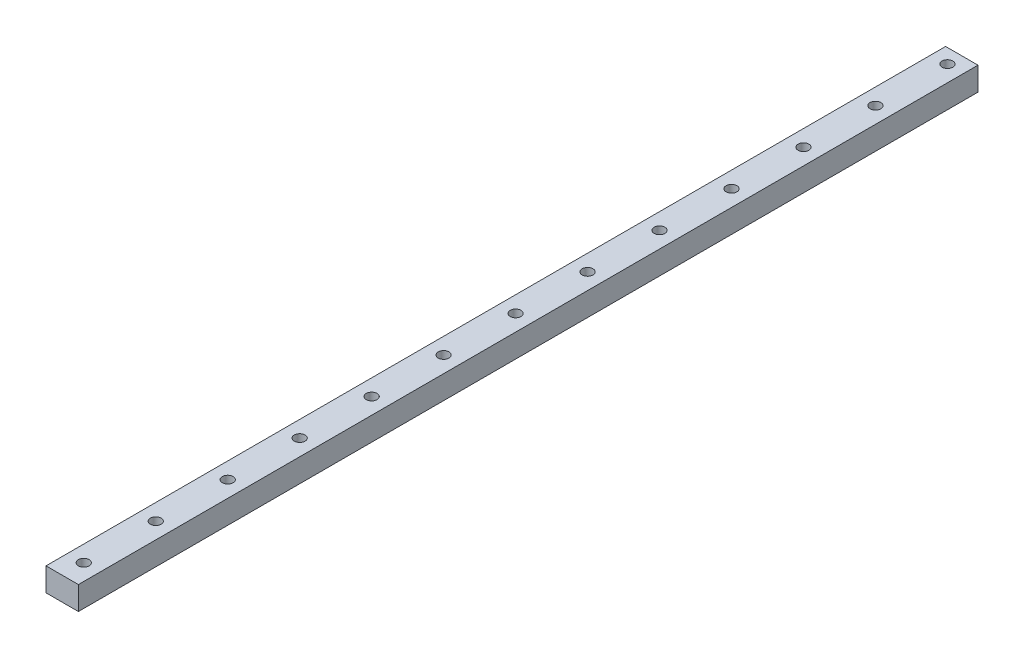
from build123d import *

# Parameters (mm, degrees)
SKETCH_1_W          = 9
SKETCH_1_H          = 6.5
EXTRUDE_1_DEPTH     = 250
SKETCH_2_R          = 1.5
CUT_EXTRUDE_1_DEPTH = 250


with BuildPart() as part:
    # 草图1 → 凸台-拉伸1 (new body)
    with BuildSketch(Plane.XY):
        Rectangle(SKETCH_1_W, SKETCH_1_H)
    extrude(amount=EXTRUDE_1_DEPTH)

    # 草图2 → 切除-拉伸1 (cut)
    with BuildSketch(Plane(origin=(0, 3.25, 0), x_dir=(1, 0, 0), z_dir=(0, 1, 0))):
        with Locations(Location((0, -4, 0), (0, 0, 270))):
            Circle(SKETCH_2_R)
        with Locations(Location((0, -24, 0), (0, 0, 270))):
            Circle(SKETCH_2_R)
        with Locations(Location((0, -44, 0), (0, 0, 270))):
            Circle(SKETCH_2_R)
        with Locations(Location((0, -64, 0), (0, 0, 270))):
            Circle(SKETCH_2_R)
        with Locations(Location((0, -84, 0), (0, 0, 270))):
            Circle(SKETCH_2_R)
        with Locations(Location((0, -104, 0), (0, 0, 270))):
            Circle(SKETCH_2_R)
        with Locations(Location((0, -124, 0), (0, 0, 270))):
            Circle(SKETCH_2_R)
        with Locations(Location((0, -144, 0), (0, 0, 270))):
            Circle(SKETCH_2_R)
        with Locations(Location((0, -164, 0), (0, 0, 270))):
            Circle(SKETCH_2_R)
        with Locations(Location((0, -184, 0), (0, 0, 270))):
            Circle(SKETCH_2_R)
        with Locations(Location((0, -204, 0), (0, 0, 270))):
            Circle(SKETCH_2_R)
        with Locations(Location((0, -224, 0), (0, 0, 270))):
            Circle(SKETCH_2_R)
        with Locations(Location((0, -244, 0), (0, 0, 270))):
            Circle(SKETCH_2_R)
    extrude(amount=-CUT_EXTRUDE_1_DEPTH, mode=Mode.SUBTRACT)


solid = part.part
